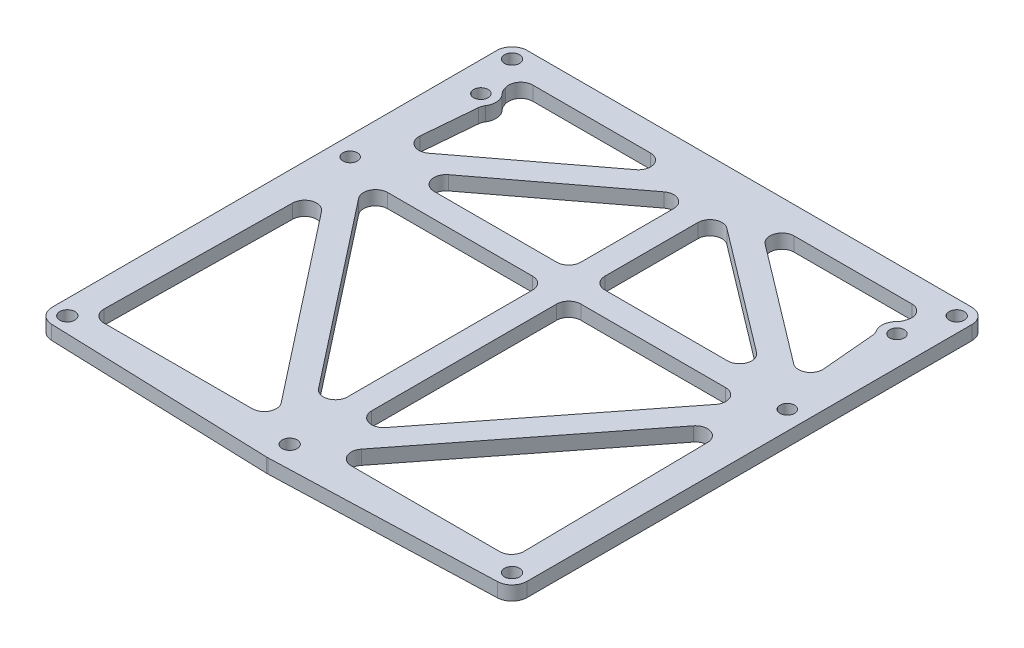
from build123d import *

# Parameters (mm, degrees)
SKETCH2_R           = 3.175
SKETCH2_R_2         = 1.5875
SKETCH2_R_3         = 4.7625
SKETCH2_R_4         = 1.524
BOSS_EXTRUDE2_DEPTH = 2.9718
CUT_EXTRUDE1_DEPTH  = 72.903419609
FILLET1_R           = 2.54


with BuildPart() as part:
    # Sketch2 → Boss-Extrude2 (new body)
    # profile 1 of 10: a face of its own
    with BuildSketch(Plane(origin=(0, 0, 0), x_dir=(1, 0, 0), z_dir=(0, 1, 0))):
        with BuildLine():
            ThreePointArc((4.7625, -46.825), (3.424205755, -50.135018308), (0.161462226, -51.5847622))
            Line((0.161462226, -51.5847622), (46.932641484, -49.9981748))
            ThreePointArc((46.932641484, -49.9981748), (44.542196163, -44.618321128), (50, -46.825))
            Line((50, -46.825), (50, 46.825))
            ThreePointArc((50, 46.825), (44.57993597, 44.57993597), (46.825, 50))
            Line((46.825, 50), (-46.825, 50))
            ThreePointArc((-46.825, 50), (-44.57993597, 49.07006403), (-43.65, 46.825))
            ThreePointArc((-43.65, 46.825), (-46.825, 43.65), (-50, 46.825))
            Line((-50, 46.825), (-50, -46.825))
            ThreePointArc((-50, -46.825), (-46.825, -43.65), (-43.65, -46.825))
            ThreePointArc((-43.65, -46.825), (-44.618321128, -49.107803837), (-46.932641484, -49.9981748))
            Line((-46.932641484, -49.9981748), (-0.161462226, -51.5847622))
            ThreePointArc((-0.161462226, -51.5847622), (-3.310018308, -43.400794245), (4.7625, -46.825))
        make_face()
        with Locations((-46.026877933, 11.948327334)):
            Circle(SKETCH2_R, mode=Mode.SUBTRACT)
        with Locations((-43.813122067, 37.251672666)):
            Circle(SKETCH2_R, mode=Mode.SUBTRACT)
        with Locations((46.026877933, 11.948327334)):
            Circle(SKETCH2_R, mode=Mode.SUBTRACT)
        with Locations((43.813122067, 37.251672666)):
            Circle(SKETCH2_R, mode=Mode.SUBTRACT)
    # profile 2 of 10: a face of its own
    with BuildSketch(Plane(origin=(0, 0, 0), x_dir=(1, 0, 0), z_dir=(0, 1, 0))):
        with Locations((-46.825, -46.825)):
            Circle(SKETCH2_R)
        with Locations(Location((-46.825, -46.825, 0), (0, 0, 270))):
            Circle(SKETCH2_R_2, mode=Mode.SUBTRACT)
    # profile 3 of 10: a face of its own
    with BuildSketch(Plane(origin=(0, 0, 0), x_dir=(1, 0, 0), z_dir=(0, 1, 0))):
        with Locations((0, -46.825)):
            Circle(SKETCH2_R_3)
        with Locations(Location((0, -46.825, 0), (0, 0, 270))):
            Circle(SKETCH2_R_2, mode=Mode.SUBTRACT)
    # profile 4 of 10: a face of its own
    with BuildSketch(Plane(origin=(0, 0, 0), x_dir=(1, 0, 0), z_dir=(0, 1, 0))):
        with Locations((46.825, -46.825)):
            Circle(SKETCH2_R)
        with Locations(Location((46.825, -46.825, 0), (0, 0, 270))):
            Circle(SKETCH2_R_2, mode=Mode.SUBTRACT)
    # profile 5 of 10: a face of its own
    with BuildSketch(Plane(origin=(0, 0, 0), x_dir=(1, 0, 0), z_dir=(0, 1, 0))):
        with Locations((46.026877933, 11.948327334)):
            Circle(SKETCH2_R)
        with Locations(Location((46.026877933, 11.948327334, 0), (0, 0, 270))):
            Circle(SKETCH2_R_4, mode=Mode.SUBTRACT)
    # profile 6 of 10: a face of its own
    with BuildSketch(Plane(origin=(0, 0, 0), x_dir=(1, 0, 0), z_dir=(0, 1, 0))):
        with Locations((43.813122067, 37.251672666)):
            Circle(SKETCH2_R)
        with Locations(Location((43.813122067, 37.251672666, 0), (0, 0, 270))):
            Circle(SKETCH2_R_4, mode=Mode.SUBTRACT)
    # profile 7 of 10: a face of its own
    with BuildSketch(Plane(origin=(0, 0, 0), x_dir=(1, 0, 0), z_dir=(0, 1, 0))):
        with Locations((46.825, 46.825)):
            Circle(SKETCH2_R)
        with Locations(Location((46.825, 46.825, 0), (0, 0, 270))):
            Circle(SKETCH2_R_2, mode=Mode.SUBTRACT)
    # profile 8 of 10: a face of its own
    with BuildSketch(Plane(origin=(0, 0, 0), x_dir=(1, 0, 0), z_dir=(0, 1, 0))):
        with Locations((-43.813122067, 37.251672666)):
            Circle(SKETCH2_R)
        with Locations(Location((-43.813122067, 37.251672666, 0), (0, 0, 270))):
            Circle(SKETCH2_R_4, mode=Mode.SUBTRACT)
    # profile 9 of 10: a face of its own
    with BuildSketch(Plane(origin=(0, 0, 0), x_dir=(1, 0, 0), z_dir=(0, 1, 0))):
        with Locations((-46.825, 46.825)):
            Circle(SKETCH2_R)
        with Locations(Location((-46.825, 46.825, 0), (0, 0, 270))):
            Circle(SKETCH2_R_2, mode=Mode.SUBTRACT)
    # profile 10 of 10: a face of its own
    with BuildSketch(Plane(origin=(0, 0, 0), x_dir=(1, 0, 0), z_dir=(0, 1, 0))):
        with Locations((-46.026877933, 11.948327334)):
            Circle(SKETCH2_R)
        with Locations(Location((-46.026877933, 11.948327334, 0), (0, 0, 270))):
            Circle(SKETCH2_R_4, mode=Mode.SUBTRACT)
    extrude(amount=BOSS_EXTRUDE2_DEPTH)

    # Sketch3 → Cut-Extrude1 (cut, through all)
    with BuildSketch(Plane(origin=(0, 0, 0), x_dir=(1, 0, 0), z_dir=(0, 1, 0))):
        Polygon((-5.215323358, -44.285), (-43.584931126, 4.710491728), (-44.250273466, -44.285), align=None)
        Polygon((-2.54, 9.408327334), (-40.811554575, 9.408327334), (-2.54, -39.461956848), align=None)
        Polygon((2.54, -39.461956848), (40.811554575, 9.408327334), (2.54, 9.408327334), align=None)
        Polygon((44.250273466, -44.285), (43.584931126, 4.710491728), (5.215323358, -44.285), align=None)
        with BuildLine():
            Line((43.363147562, 44.285), (7.557737131, 44.285))
            Line((7.557737131, 44.285), (42.997535117, 17.43064252))
            Line((42.997535117, 17.43064252), (41.448819224, 35.132546179))
            ThreePointArc((41.448819224, 35.132546179), (40.65688527, 37.596338128), (41.961912119, 39.831139031))
            Line((41.961912119, 39.831139031), (43.363147562, 44.285))
        make_face()
        Polygon((38.469140802, 14.488327334), (2.54, 41.713482269), (2.54, 14.488327334), align=None)
        Polygon((-2.54, 14.488327334), (-2.54, 41.713482269), (-38.469140802, 14.488327334), align=None)
        with BuildLine():
            Line((-42.997535117, 17.43064252), (-7.557737131, 44.285))
            Line((-7.557737131, 44.285), (-43.363147562, 44.285))
            Line((-43.363147562, 44.285), (-41.961912119, 39.831139031))
            ThreePointArc((-41.961912119, 39.831139031), (-40.988390524, 38.70133356), (-40.638122067, 37.251672666))
            ThreePointArc((-40.638122067, 37.251672666), (-40.847714294, 36.117220491), (-41.448819224, 35.132546179))
            Line((-41.448819224, 35.132546179), (-42.997535117, 17.43064252))
        make_face()
    extrude(amount=CUT_EXTRUDE1_DEPTH, mode=Mode.SUBTRACT)

    # Fillet1
    fillet1_edges = [part.edges().sort_by_distance(p)[0] for p in [
        (41.448819224, 1.4859, -35.132546179),
        (41.961912119, 1.4859, -39.831139031),
        (43.363147562, 1.4859, -44.285),
        (7.557737131, 1.4859, -44.285),
        (42.997535117, 1.4859, -17.43064252),
        (5.215323358, 1.4859, 44.285),
        (44.250273466, 1.4859, 44.285),
        (43.584931126, 1.4859, -4.710491728),
        (40.811554575, 1.4859, -9.408327334),
        (2.54, 1.4859, -9.408327334),
        (2.54, 1.4859, 39.461956848),
        (-2.54, 1.4859, 39.461956848),
        (-2.54, 1.4859, -9.408327334),
        (-40.811554575, 1.4859, -9.408327334),
        (-41.961912119, 1.4859, -39.831139031),
        (-41.448819224, 1.4859, -35.132546179),
        (-42.997535117, 1.4859, -17.43064252),
        (-7.557737131, 1.4859, -44.285),
        (-43.363147562, 1.4859, -44.285),
        (-2.54, 1.4859, -41.713482269),
        (-38.469140802, 1.4859, -14.488327334),
        (-2.54, 1.4859, -14.488327334),
        (2.54, 1.4859, -41.713482269),
        (2.54, 1.4859, -14.488327334),
        (38.469140802, 1.4859, -14.488327334),
        (-43.584931126, 1.4859, -4.710491728),
        (-44.250273466, 1.4859, 44.285),
        (-5.215323358, 1.4859, 44.285),
    ]]
    fillet(fillet1_edges, radius=FILLET1_R)


solid = part.part
